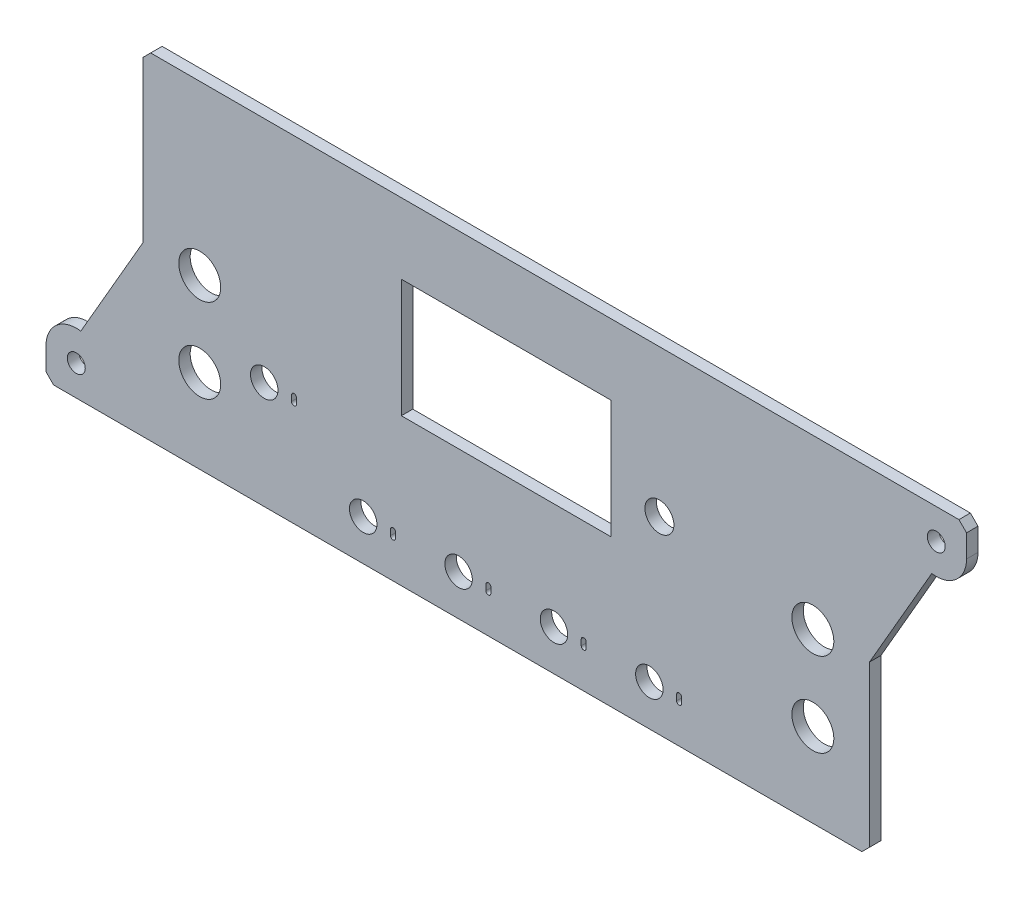
from build123d import *

# Parameters (mm, degrees)
SKETCH1_R           = 2.35
SKETCH1_R_2         = 5.5
SKETCH1_R_3         = 3.6
SKETCH1_R_4         = 3.8
SKETCH1_W           = 55
SKETCH1_H           = 31
BOSS_EXTRUDE1_DEPTH = 3


with BuildPart() as part:
    # Sketch1 → Boss-Extrude1 (new body)
    with BuildSketch(Plane.XY):
        with BuildLine():
            Line((-95.217720642, 42.05), (-95.217720642, 0))
            Line((-95.217720642, 0), (-111.532377856, -28.257815203))
            ThreePointArc((-111.532377856, -28.257815203), (-117.891374344, -30.093609063), (-120.65, -36.11))
            Line((-120.65, -36.11), (-120.65, -42.05))
            Line((-120.65, -42.05), (-118.65, -44.05))
            Line((-118.65, -44.05), (93.217720642, -44.05))
            Line((93.217720642, -44.05), (95.217720642, -42.05))
            Line((95.217720642, -42.05), (95.217720642, 0))
            Line((95.217720642, 0), (111.532377856, 28.257815203))
            ThreePointArc((111.532377856, 28.257815203), (117.891374344, 30.093609063), (120.65, 36.11))
            Line((120.65, 36.11), (120.65, 42.05))
            Line((120.65, 42.05), (118.65, 44.05))
            Line((118.65, 44.05), (-93.217720642, 44.05))
            Line((-93.217720642, 44.05), (-95.217720642, 42.05))
        make_face()
        with Locations((-112.71, -36.11)):
            Circle(SKETCH1_R, mode=Mode.SUBTRACT)
        with Locations((-80.357720642, -22.025)):
            Circle(SKETCH1_R_2, mode=Mode.SUBTRACT)
        with Locations((-37.5, -33.344646258)):
            Circle(SKETCH1_R_3, mode=Mode.SUBTRACT)
        with BuildLine():
            ThreePointArc((-30.35, -32.594646258), (-29.7, -31.944646258), (-29.05, -32.594646258))
            Line((-29.05, -32.594646258), (-29.05, -34.094646258))
            ThreePointArc((-29.05, -34.094646258), (-29.7, -34.744646258), (-30.35, -34.094646258))
            Line((-30.35, -34.094646258), (-30.35, -32.594646258))
        make_face(mode=Mode.SUBTRACT)
        with Locations((-12.5, -33.344646258)):
            Circle(SKETCH1_R_3, mode=Mode.SUBTRACT)
        with BuildLine():
            Line((-5.35, -34.094646258), (-5.35, -32.594646258))
            ThreePointArc((-5.35, -32.594646258), (-4.7, -31.944646258), (-4.05, -32.594646258))
            Line((-4.05, -32.594646258), (-4.05, -34.094646258))
            ThreePointArc((-4.05, -34.094646258), (-4.7, -34.744646258), (-5.35, -34.094646258))
        make_face(mode=Mode.SUBTRACT)
        with Locations((12.5, -33.344646258)):
            Circle(SKETCH1_R_3, mode=Mode.SUBTRACT)
        with BuildLine():
            Line((19.65, -34.094646258), (19.65, -32.594646258))
            ThreePointArc((19.65, -32.594646258), (20.3, -31.944646258), (20.95, -32.594646258))
            Line((20.95, -32.594646258), (20.95, -34.094646258))
            ThreePointArc((20.95, -34.094646258), (20.3, -34.744646258), (19.65, -34.094646258))
        make_face(mode=Mode.SUBTRACT)
        with Locations((37.5, -33.344646258)):
            Circle(SKETCH1_R_3, mode=Mode.SUBTRACT)
        with BuildLine():
            Line((44.65, -34.094646258), (44.65, -32.594646258))
            ThreePointArc((44.65, -32.594646258), (45.3, -31.944646258), (45.95, -32.594646258))
            Line((45.95, -32.594646258), (45.95, -34.094646258))
            ThreePointArc((45.95, -34.094646258), (45.3, -34.744646258), (44.65, -34.094646258))
        make_face(mode=Mode.SUBTRACT)
        with Locations((80.358860321, -22.025)):
            Circle(SKETCH1_R_2, mode=Mode.SUBTRACT)
        with Locations((-80.357720642, 0)):
            Circle(SKETCH1_R_2, mode=Mode.SUBTRACT)
        with Locations((40.137585267, 5.460707483)):
            Circle(SKETCH1_R_4, mode=Mode.SUBTRACT)
        with Locations((0, 10.05)):
            Rectangle(SKETCH1_W, SKETCH1_H, mode=Mode.SUBTRACT)
        with BuildLine():
            ThreePointArc((74.858860321, 0), (80.358860321, 5.5), (85.858860321, 0))
            ThreePointArc((85.858860321, 0), (80.358860321, -5.5), (74.858860321, 0))
        make_face(mode=Mode.SUBTRACT)
        with Locations((112.71, 36.11)):
            Circle(SKETCH1_R, mode=Mode.SUBTRACT)
        with BuildLine():
            ThreePointArc((-54.993253468, -16.61863742), (-55.643253468, -17.26863742), (-56.293253468, -16.61863742))
            Line((-56.293253468, -16.61863742), (-56.293253468, -15.11863742))
            ThreePointArc((-56.293253468, -15.11863742), (-55.643253468, -14.46863742), (-54.993253468, -15.11863742))
            Line((-54.993253468, -15.11863742), (-54.993253468, -16.61863742))
        make_face(mode=Mode.SUBTRACT)
        with Locations((-63.443253468, -15.86863742)):
            Circle(SKETCH1_R_3, mode=Mode.SUBTRACT)
    extrude(amount=BOSS_EXTRUDE1_DEPTH)


solid = part.part
